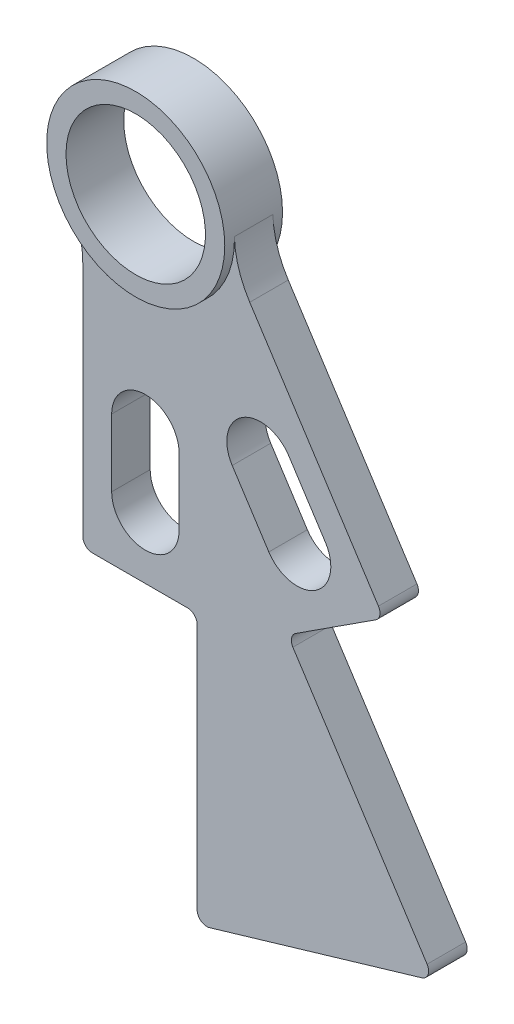
from build123d import *

# Parameters (mm, degrees)
SKETCH1_R           = 11.495405
BOSS_EXTRUDE2_DEPTH = 4.7625
BOSS_EXTRUDE3_DEPTH = 3.175
FILLET1_R           = 1.5875


with BuildPart() as part:
    # Sketch1 → Boss-Extrude2 (new, symmetric)
    with BuildSketch(Plane.XY):
        with BuildLine():
            ThreePointArc((14.672983865, 0.491098707), (-4.158599684, 14.079903484), (-12.585193267, -7.559797873))
            ThreePointArc((-12.585193267, -7.559797873), (4.158599684, -14.079903484), (14.672983865, 0.491098707))
        make_face()
        Circle(SKETCH1_R, mode=Mode.SUBTRACT)
    extrude(amount=BOSS_EXTRUDE2_DEPTH, both=True)

    # Sketch1<4> → Boss-Extrude3 (add, symmetric)
    with BuildSketch(Plane.XY):
        with BuildLine():
            ThreePointArc((-12.585193267, -7.559797873), (-10.89585042, -11.492870345), (-10.31875, -15.734319794))
            Line((-10.31875, -15.734319794), (-10.31875, -56.374319794))
            Line((-10.31875, -56.374319794), (8.54075, -56.374319794))
            Line((8.54075, -56.374319794), (8.54075, -100.824319794))
            Line((8.54075, -100.824319794), (47.609422672, -89.285109315))
            Line((47.609422672, -89.285109315), (23.458960581, -51.968120144))
            Line((23.458960581, -51.968120144), (39.292025986, -41.721424085))
            Line((39.292025986, -41.721424085), (17.211603503, -7.603033986))
            ThreePointArc((17.211603503, -7.603033986), (15.391641433, -3.728672569), (14.672983865, 0.491098707))
            ThreePointArc((14.672983865, 0.491098707), (4.158599684, -14.079903484), (-12.585193267, -7.559797873))
        make_face()
        with BuildLine():
            ThreePointArc((5.55625, -46.055569794), (0, -51.611819794), (-5.55625, -46.055569794))
            Line((-5.55625, -46.055569794), (-5.55625, -34.943069794))
            ThreePointArc((-5.55625, -34.943069794), (0, -29.386819794), (5.55625, -34.943069794))
            Line((5.55625, -34.943069794), (5.55625, -46.055569794))
        make_face(mode=Mode.SUBTRACT)
        with BuildLine():
            ThreePointArc((29.687419875, -35.646101109), (28.04160399, -43.329532516), (20.358172583, -41.683716631))
            Line((20.358172583, -41.683716631), (14.32055706, -32.354469339))
            ThreePointArc((14.32055706, -32.354469339), (15.966372945, -24.671037931), (23.649804353, -26.316853816))
            Line((23.649804353, -26.316853816), (29.687419875, -35.646101109))
        make_face(mode=Mode.SUBTRACT)
    extrude(amount=BOSS_EXTRUDE3_DEPTH, both=True)

    # Fillet1
    fillet1_edges = [part.edges().sort_by_distance(p)[0] for p in [
        (-10.31875, -56.374319794, 0),
        (39.292025986, -41.721424085, 0),
        (8.54075, -100.824319794, 0),
        (47.609422672, -89.285109315, 0),
        (23.458960581, -51.968120144, 0),
        (8.54075, -56.374319794, 0),
    ]]
    fillet(fillet1_edges, radius=FILLET1_R)


solid = part.part
